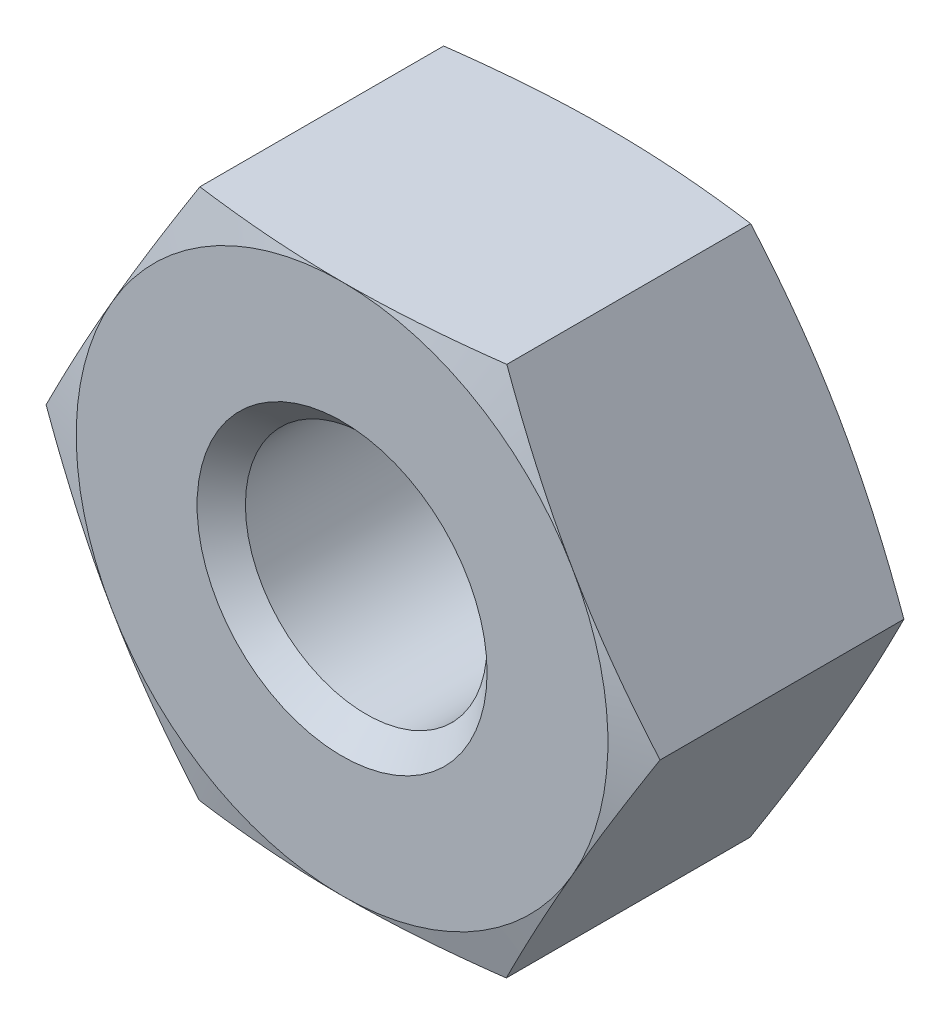
from build123d import *

# Parameters (mm, degrees)
RESSALTO_EXTRUS_O2_DEPTH        = 5.5
ESBO_O3_OUTSIDE_W               = 115.272
ESBO_O3_OUTSIDE_H               = 113.576
ESBO_O3_OUTSIDE_R               = 5.5
CORTE_EXTRUS_O1_DEPTH           = 13
CORTE_EXTRUS_O1_DRAFT           = -75
ESBO_O4_OUTSIDE_W               = 115.272
ESBO_O4_OUTSIDE_H               = 113.576
ESBO_O4_OUTSIDE_R               = 5.5
CORTE_EXTRUS_O2_DEPTH           = 13
CORTE_EXTRUS_O2_DRAFT           = -75
FURO_ROSCADO_DE_M61_D           = 5
FURO_ROSCADO_DE_M61_CSINK_D     = 6.05
FURO_ROSCADO_DE_M61_CSINK_ANGLE = 90
CHANFRO1_SIZE                   = 0.5


with BuildPart() as part:
    # Esboço2 → Ressalto-extrusão2 (new body)
    with BuildSketch(Plane.XY):
        Polygon((3.180933655, 5.496816753), (-3.169916121, 5.503177729), (-6.350849776, 0.006360976), (-3.180933655, -5.496816753), (3.169916121, -5.503177729), (6.350849776, -0.006360976), align=None)
    extrude(amount=RESSALTO_EXTRUS_O2_DEPTH)


with BuildPart() as corte_extrus_o1_tool:
    # Esboço3 outside → Corte-extrusão1 (with draft: the straight prism first)
    with BuildSketch(Plane.XY.offset(5.5)):
        Rectangle(ESBO_O3_OUTSIDE_W, ESBO_O3_OUTSIDE_H)
        Circle(ESBO_O3_OUTSIDE_R, mode=Mode.SUBTRACT)
    extrude(amount=-CORTE_EXTRUS_O1_DEPTH)
    # Corte-extrusão1: the draft: its side faces are tilted about the plane it starts from
    corte_extrus_o1_sides = [corte_extrus_o1_tool.faces().sort_by_distance(p)[0] for p in [
        (0, -56.788, -1),
        (57.636, 0, -1),
        (0, 56.788, -1),
        (-57.636, 0, -1),
        (-5.5, 0, -1),
    ]]
    draft(corte_extrus_o1_sides, Plane.XY.offset(5.5), CORTE_EXTRUS_O1_DRAFT)


with BuildPart() as part_1:
    add(part.part)

    # Corte-extrusão1: cut by corte_extrus_o1_tool
    add(corte_extrus_o1_tool.part, mode=Mode.SUBTRACT)


with BuildPart() as corte_extrus_o2_tool:
    # Esboço4 outside → Corte-extrusão2 (with draft: the straight prism first)
    with BuildSketch(Plane(origin=(0, 0, 0), x_dir=(-1, 0, 0), z_dir=(0, 0, -1))):
        Rectangle(ESBO_O4_OUTSIDE_W, ESBO_O4_OUTSIDE_H)
        Circle(ESBO_O4_OUTSIDE_R, mode=Mode.SUBTRACT)
    extrude(amount=-CORTE_EXTRUS_O2_DEPTH)
    # Corte-extrusão2: the draft: its side faces are tilted about the plane it starts from
    corte_extrus_o2_sides = [corte_extrus_o2_tool.faces().sort_by_distance(p)[0] for p in [
        (0, -56.788, 6.5),
        (-57.636, 0, 6.5),
        (0, 56.788, 6.5),
        (57.636, 0, 6.5),
        (5.5, 0, 6.5),
    ]]
    draft(corte_extrus_o2_sides, Plane(origin=(0, 0, 0), x_dir=(-1, 0, 0), z_dir=(0, 0, -1)), CORTE_EXTRUS_O2_DRAFT)


with BuildPart() as part_2:
    add(part_1.part)

    # Corte-extrusão2: cut by corte_extrus_o2_tool
    add(corte_extrus_o2_tool.part, mode=Mode.SUBTRACT)

    # Furo roscado de M61 (through all)
    with Locations(Plane(origin=(0, 0, 0), x_dir=(-1, 0, 0), z_dir=(0, 0, -1))):
        with Locations((0, 0)):
            CounterSinkHole(FURO_ROSCADO_DE_M61_D / 2, FURO_ROSCADO_DE_M61_CSINK_D / 2, counter_sink_angle=FURO_ROSCADO_DE_M61_CSINK_ANGLE)

    # Chanfro1
    chanfro1_edges = [part_2.edges().sort_by_distance(p)[0] for p in [
        (-2.5, 0, 5.5),
    ]]
    chamfer(chanfro1_edges, length=CHANFRO1_SIZE)


solid = part_2.part
